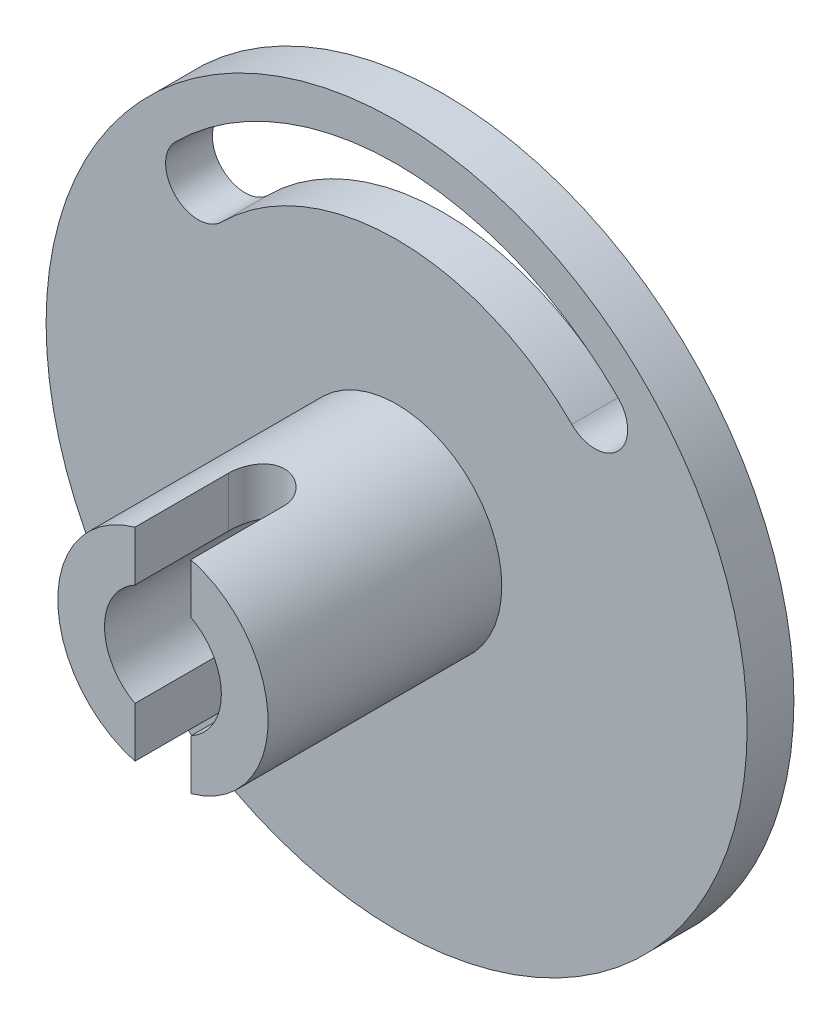
from build123d import *

# Parameters (mm, degrees)
SKETCH1_R           = 75
BOSS_EXTRUDE1_DEPTH = 10
SKETCH2_R           = 22.5
BOSS_EXTRUDE2_DEPTH = 50
CUT_EXTRUDE1_DEPTH  = 30
CUT_EXTRUDE2_DEPTH  = 118.260394038
SKETCH5_R           = 12.5
CUT_EXTRUDE3_DEPTH  = 122.86057607


with BuildPart() as part:
    # Sketch1 → Boss-Extrude1 (new body)
    with BuildSketch(Plane.XY):
        Circle(SKETCH1_R)
    extrude(amount=BOSS_EXTRUDE1_DEPTH)

    # Sketch2 → Boss-Extrude2 (add)
    with BuildSketch(Plane.XY.offset(10)):
        Circle(SKETCH2_R)
    extrude(amount=BOSS_EXTRUDE2_DEPTH)

    # Sketch3 → Cut-Extrude1 (cut, symmetric)
    with BuildSketch(Plane(origin=(0, 0, 0), x_dir=(1, 0, 0), z_dir=(0, 1, 0))):
        with BuildLine():
            Line((6, -40), (6, -60))
            ThreePointArc((6, -60), (0, -66), (-6, -60))
            Line((-6, -60), (-6, -40))
            ThreePointArc((-6, -40), (0, -34), (6, -40))
        make_face()
    extrude(amount=CUT_EXTRUDE1_DEPTH, both=True, mode=Mode.SUBTRACT)

    # Sketch4 → Cut-Extrude2 (cut, through all)
    with BuildSketch(Plane.XY.offset(10)):
        with BuildLine():
            ThreePointArc((37.476659403, 37.476659403), (0, 53), (-37.476659403, 37.476659403))
            ThreePointArc((-37.476659403, 37.476659403), (-47.376154339, 37.476659403), (-47.376154339, 47.376154339))
            ThreePointArc((-47.376154339, 47.376154339), (0, 67), (47.376154339, 47.376154339))
            ThreePointArc((47.376154339, 47.376154339), (47.376154339, 37.476659403), (37.476659403, 37.476659403))
        make_face()
    extrude(amount=-CUT_EXTRUDE2_DEPTH, mode=Mode.SUBTRACT)

    # Sketch5 → Cut-Extrude3 (cut, through all)
    with BuildSketch(Plane.XY.offset(60)):
        Circle(SKETCH5_R)
    extrude(amount=-CUT_EXTRUDE3_DEPTH, mode=Mode.SUBTRACT)


solid = part.part
